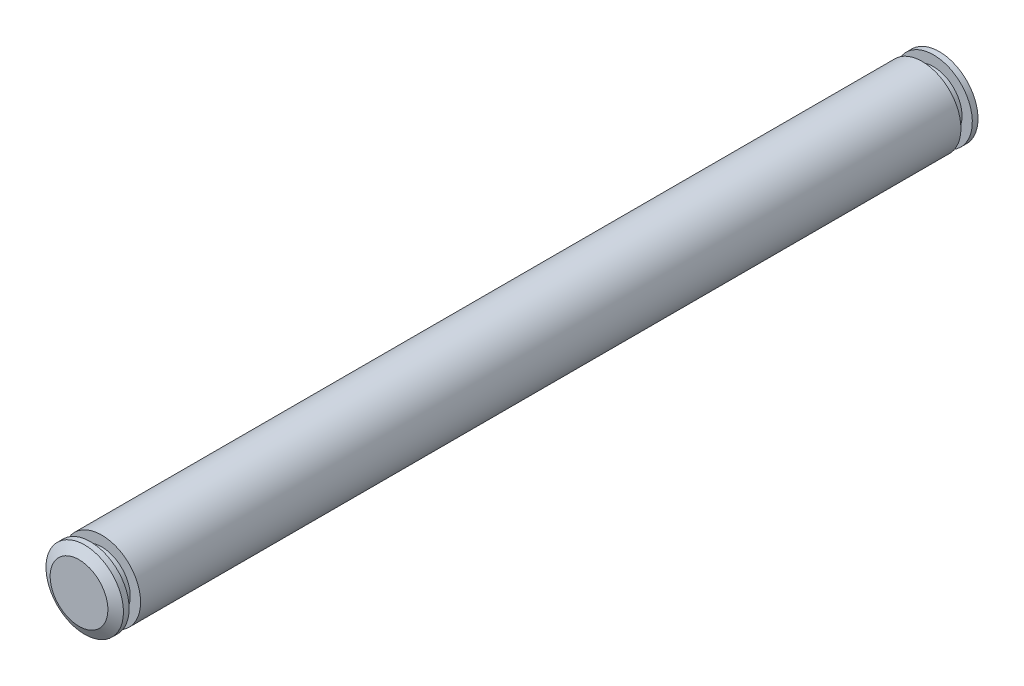
from build123d import *

# Parameters (mm, degrees)
CHAMFER1_SIZE      = 0.5
CHAMFER1_SIZE2     = 0.866025404
CUT_EXTRUDE1_START = -1
SKETCH2_OUTSIDE_W  = 24.122
SKETCH2_OUTSIDE_H  = 24.122
SKETCH2_OUTSIDE_R  = 2.5
CUT_EXTRUDE1_DEPTH = 1


with BuildPart() as part:
    # Sketch1 → Revolve1 (revolve)
    with BuildSketch(Plane(origin=(0, 0, 0), x_dir=(0, 0, -1), z_dir=(1, 0, 0)), mode=Mode.PRIVATE) as revolve1_sk:
        Polygon((-38, 0), (-38, 3.4), (2.432191781, 3.4), (38, 3.4), (38, 0), align=None)
    revolve(revolve1_sk.sketch.rotate(Axis((0, 0, 38), (0, 0, -1)), 180), axis=Axis((0, 0, 38), (0, 0, -1)))

    # Chamfer1
    chamfer1_edges = [part.edges().sort_by_distance(p)[0] for p in [
        (0, 3.4, -38),
        (0, 3.4, 38),
    ]]
    chamfer1_side = [part.faces().sort_by_distance(p)[0] for p in [
        (0, 3.4, 0),
    ]]
    chamfer(chamfer1_edges, length=CHAMFER1_SIZE, length2=CHAMFER1_SIZE2, reference=chamfer1_side[0])

    # Sketch2 outside → Cut-Extrude1 (cut)
    with BuildSketch(Plane(origin=(0, 0, -38), x_dir=(-1, 0, 0), z_dir=(0, 0, -1)).offset(CUT_EXTRUDE1_START)):
        Rectangle(SKETCH2_OUTSIDE_W, SKETCH2_OUTSIDE_H)
        Circle(SKETCH2_OUTSIDE_R, mode=Mode.SUBTRACT)
    cut_extrude1 = extrude(amount=-CUT_EXTRUDE1_DEPTH, mode=Mode.SUBTRACT)

    # Mirror1: Cut-Extrude1 across plane
    add(cut_extrude1.mirror(Plane.XY), mode=Mode.SUBTRACT)


solid = part.part
